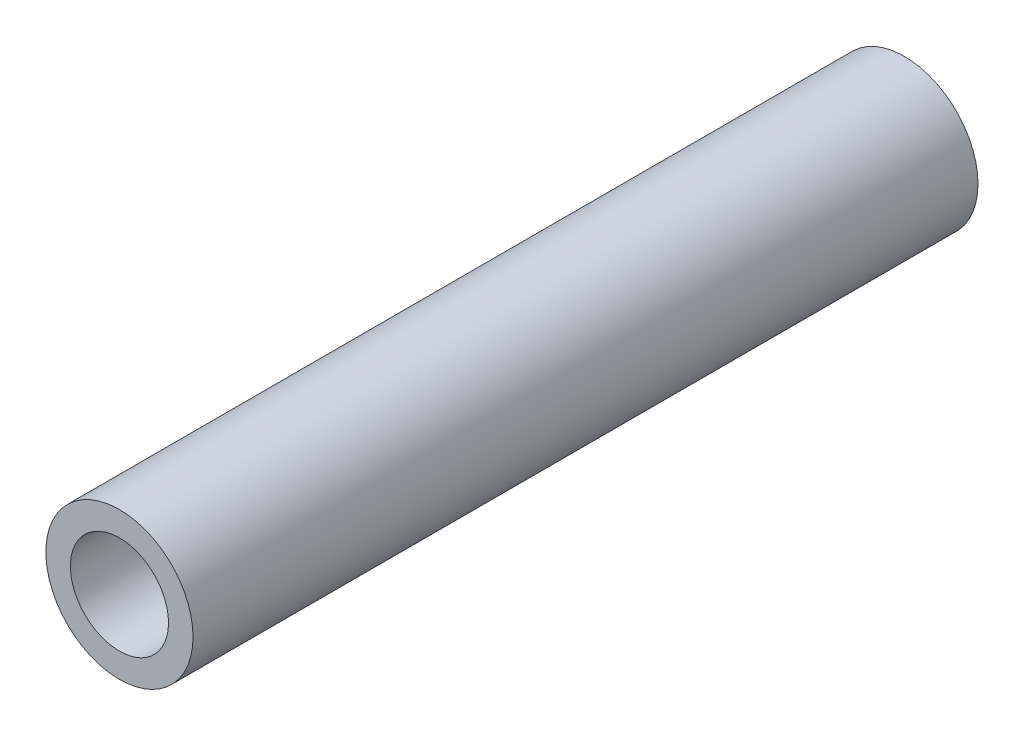
from build123d import *

# Parameters (mm, degrees)
SKETCH1_R           = 3
SKETCH1_R_2         = 2
BOSS_EXTRUDE1_DEPTH = 32


with BuildPart() as part:
    # Sketch1 → Boss-Extrude1 (new body)
    with BuildSketch(Plane.XY):
        Circle(SKETCH1_R)
        Circle(SKETCH1_R_2, mode=Mode.SUBTRACT)
    extrude(amount=BOSS_EXTRUDE1_DEPTH)


solid = part.part
